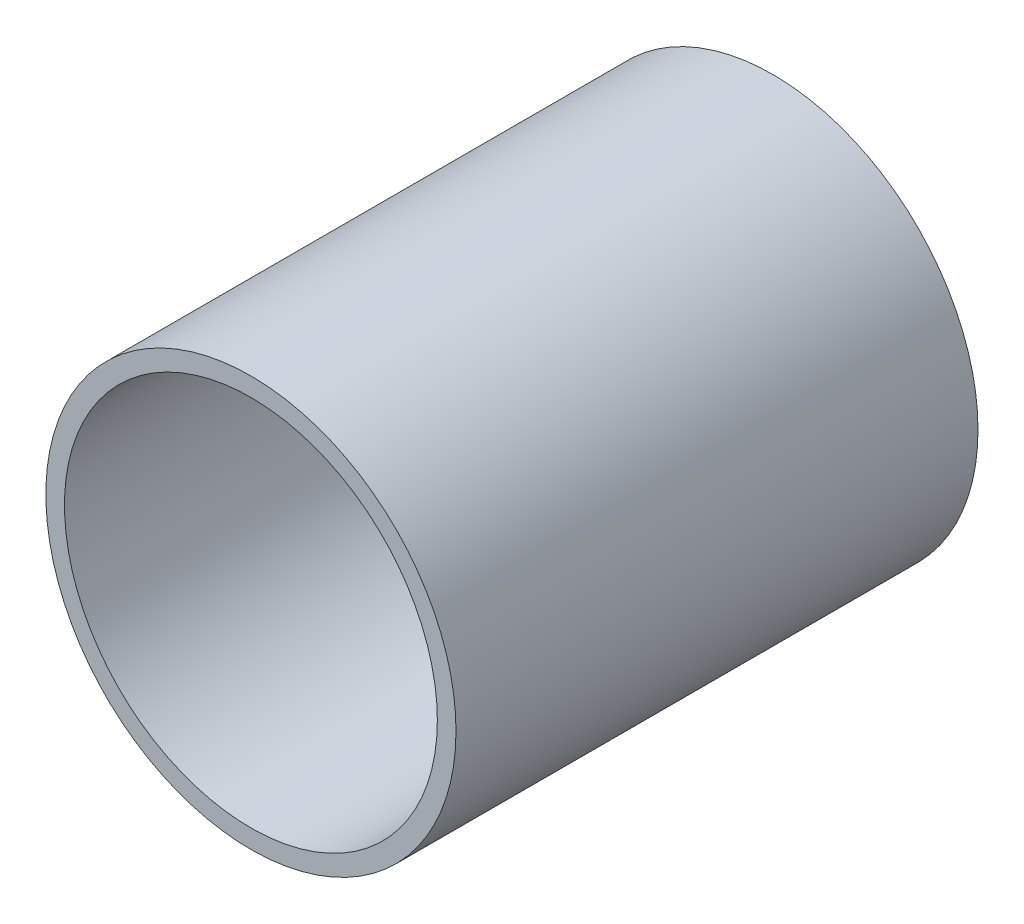
from build123d import *

# Parameters (mm, degrees)
SKETCH1_R           = 69.85
BOSS_EXTRUDE1_DEPTH = 177.8
SKETCH2_R           = 25.4
CUT_EXTRUDE1_DEPTH  = 204.398340701
SKETCH3_R           = 63.5
CUT_EXTRUDE2_DEPTH  = 165.1


with BuildPart() as part:
    # Sketch1 → Boss-Extrude1 (new body)
    with BuildSketch(Plane.XY):
        Circle(SKETCH1_R)
    extrude(amount=BOSS_EXTRUDE1_DEPTH)

    # Sketch2 → Cut-Extrude1 (cut, through all)
    with BuildSketch(Plane.XY.offset(177.8)):
        Circle(SKETCH2_R)
    extrude(amount=-CUT_EXTRUDE1_DEPTH, mode=Mode.SUBTRACT)

    # Sketch3 → Cut-Extrude2 (cut)
    with BuildSketch(Plane.XY.offset(177.8)):
        Circle(SKETCH3_R)
    extrude(amount=-CUT_EXTRUDE2_DEPTH, mode=Mode.SUBTRACT)


solid = part.part
